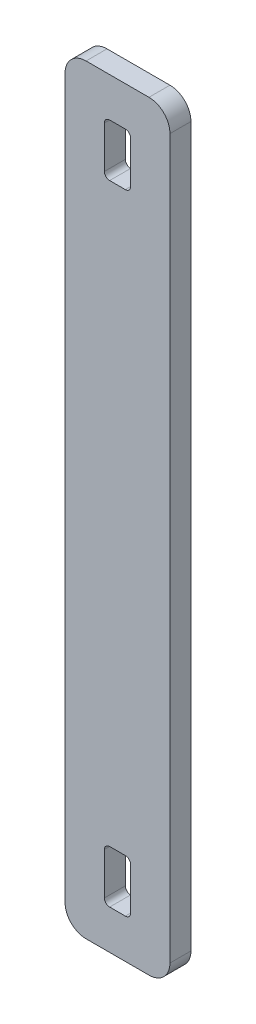
from build123d import *

# Parameters (mm, degrees)
BOSS_EXTRU_1_DEPTH      = 4
ENL_V_MAT_EXTRU_1_DEPTH = 74.295634249


with BuildPart() as part:
    # Esquisse1 → Boss.-Extru.1 (new body)
    with BuildSketch(Plane.XY):
        with BuildLine():
            Line((-6, -72.5), (6, -72.5))
            ThreePointArc((6, -72.5), (8.828427125, -71.328427125), (10, -68.5))
            Line((10, -68.5), (10, 68.5))
            ThreePointArc((10, 68.5), (8.828427125, 71.328427125), (6, 72.5))
            Line((6, 72.5), (-6, 72.5))
            ThreePointArc((-6, 72.5), (-8.828427125, 71.328427125), (-10, 68.5))
            Line((-10, 68.5), (-10, -68.5))
            ThreePointArc((-10, -68.5), (-8.828427125, -71.328427125), (-6, -72.5))
        make_face()
    extrude(amount=BOSS_EXTRU_1_DEPTH)

    # Esquisse2 → Enlèv. mat.-Extru.1 (cut, through all)
    with BuildSketch(Plane.XY.offset(4)):
        with BuildLine():
            Line((-2.5, -64), (-2.5, -56))
            ThreePointArc((-2.5, -56), (-2.207106781, -55.292893219), (-1.5, -55))
            Line((-1.5, -55), (1.5, -55))
            ThreePointArc((1.5, -55), (2.207106781, -55.292893219), (2.5, -56))
            Line((2.5, -56), (2.5, -64))
            ThreePointArc((2.5, -64), (2.207106781, -64.707106781), (1.5, -65))
            Line((1.5, -65), (-1.5, -65))
            ThreePointArc((-1.5, -65), (-2.207106781, -64.707106781), (-2.5, -64))
        make_face()
        with BuildLine():
            Line((-2.5, 56), (-2.5, 64))
            ThreePointArc((-2.5, 64), (-2.207106781, 64.707106781), (-1.5, 65))
            Line((-1.5, 65), (1.5, 65))
            ThreePointArc((1.5, 65), (2.207106781, 64.707106781), (2.5, 64))
            Line((2.5, 64), (2.5, 56))
            ThreePointArc((2.5, 56), (2.207106781, 55.292893219), (1.5, 55))
            Line((1.5, 55), (-1.5, 55))
            ThreePointArc((-1.5, 55), (-2.207106781, 55.292893219), (-2.5, 56))
        make_face()
    extrude(amount=-ENL_V_MAT_EXTRU_1_DEPTH, mode=Mode.SUBTRACT)


solid = part.part
